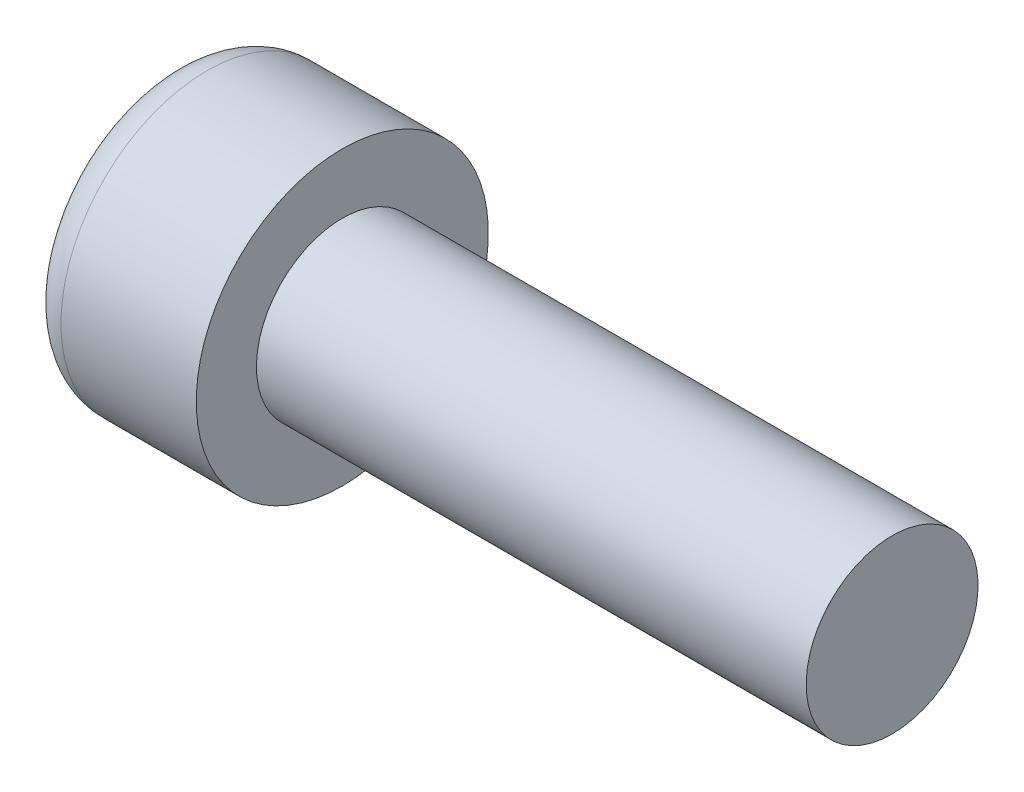
from build123d import *

# Parameters (mm, degrees)
CUT_EXTRUDE1_DEPTH = 2.5


with BuildPart() as part:
    # Sketch1 → Revolve1 (revolve)
    with BuildSketch(Plane.XY, mode=Mode.PRIVATE) as revolve1_sk:
        with BuildLine():
            Line((0, 0), (0, 3.1875))
            ThreePointArc((0, 3.1875), (0.311199045, 3.938800955), (1.0625, 4.25))
            Line((1.0625, 4.25), (5, 4.25))
            Line((5, 4.25), (5, 2.5))
            Line((5, 2.5), (21, 2.5))
            Line((21, 2.5), (21, 0))
            Line((21, 0), (0, 0))
        make_face()
    revolve(revolve1_sk.sketch.rotate(Axis((0, 0, 0), (1, 0, 0)), 180), axis=Axis((0, 0, 0), (1, 0, 0)))

    # Sketch2 → Cut-Extrude1 (cut)
    with BuildSketch(Plane.ZY):
        Polygon((0, 2.309401077), (-2, 1.154700538), (-2, -1.154700538), (0, -2.309401077), (2, -1.154700538), (2, 1.154700538), align=None)
    extrude(amount=-CUT_EXTRUDE1_DEPTH, mode=Mode.SUBTRACT)


solid = part.part
